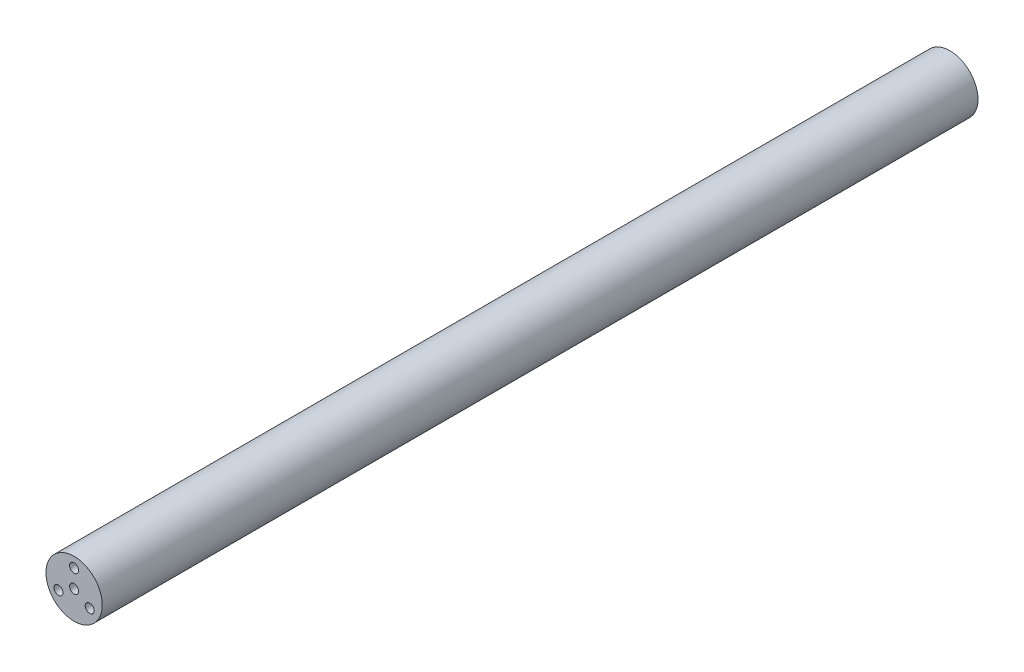
from build123d import *

# Parameters (mm, degrees)
SKETCH_1_R          = 12.5
EXTRUDE_1_DEPTH     = 194.5
SKETCH_2_R          = 8
CUT_EXTRUDE_1_DEPTH = 349
SKETCH_3_R          = 10
EXTRUDE_2_DEPTH     = 40
SKETCH_4_R          = 2
CUT_EXTRUDE_2_DEPTH = 1000
SKETCH_5_R          = 12.5
SKETCH_5_R_2        = 8
EXTRUDE_4_DEPTH     = 146.5
EXTRUDE_START       = 146.5
SKETCH_7_R          = 11.680413058
SKETCH_7_R_2        = 8
EXTRUDE_7_DEPTH     = 146.5


with BuildPart() as part:
    # 草图1 → 凸台-拉伸1 (new, symmetric)
    with BuildSketch(Plane.XY):
        Circle(SKETCH_1_R)
    extrude(amount=EXTRUDE_1_DEPTH, both=True)

    # 草图2 → 切除-拉伸1 (cut)
    with BuildSketch(Plane.XY.offset(194.5)):
        Circle(SKETCH_2_R)
    extrude(amount=-CUT_EXTRUDE_1_DEPTH, mode=Mode.SUBTRACT)

    # 草图3 → 凸台-拉伸2 (add)
    with BuildSketch(Plane.XY.offset(194.5)):
        Circle(SKETCH_3_R)
    extrude(amount=-EXTRUDE_2_DEPTH)

    # 草图4 → 切除-拉伸2 (cut)
    with BuildSketch(Plane.XY.offset(194.5)):
        with Locations((0, 8)):
            Circle(SKETCH_4_R)
        with Locations((-6.92820323, -4)):
            Circle(SKETCH_4_R)
        with Locations((6.92820323, -4)):
            Circle(SKETCH_4_R)
        Circle(SKETCH_4_R)
    extrude(amount=-CUT_EXTRUDE_2_DEPTH, mode=Mode.SUBTRACT)

    # 草图5 → 凸台-拉伸4 (add)
    with BuildSketch(Plane.XY):
        Circle(SKETCH_5_R)
        with Locations(Location((0, 0, 0), (0, 0, 344.361511563))):
            Circle(SKETCH_5_R_2, mode=Mode.SUBTRACT)
    extrude(amount=-EXTRUDE_4_DEPTH)

    # 草图7 → 凸台-拉伸7 (add)
    with BuildSketch(Plane.XY.offset(EXTRUDE_START)):
        Circle(SKETCH_7_R)
        with Locations(Location((0, 0, 0), (0, 0, 344.361511563))):
            Circle(SKETCH_7_R_2, mode=Mode.SUBTRACT)
    extrude(amount=-EXTRUDE_7_DEPTH)


solid = part.part
